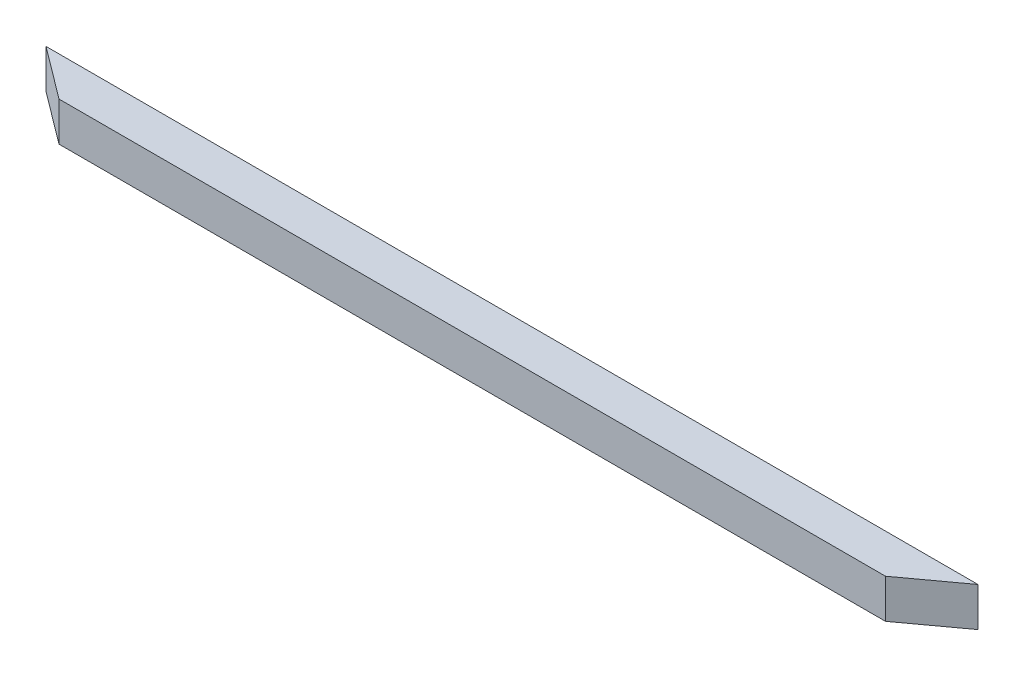
from build123d import *

# Parameters (mm, degrees)
BOSS_EXTRUDE1_DEPTH = 25.4


with BuildPart() as part:
    # Sketch2 → Boss-Extrude1 (new body)
    with BuildSketch(Plane(origin=(0, 0, 0), x_dir=(1, 0, 0), z_dir=(0, 1, 0))):
        Polygon((302.768, 12.7), (268.046906024, -12.7), (-268.904054315, -12.7), (-302.768, 12.7), align=None)
    extrude(amount=BOSS_EXTRUDE1_DEPTH)


solid = part.part
